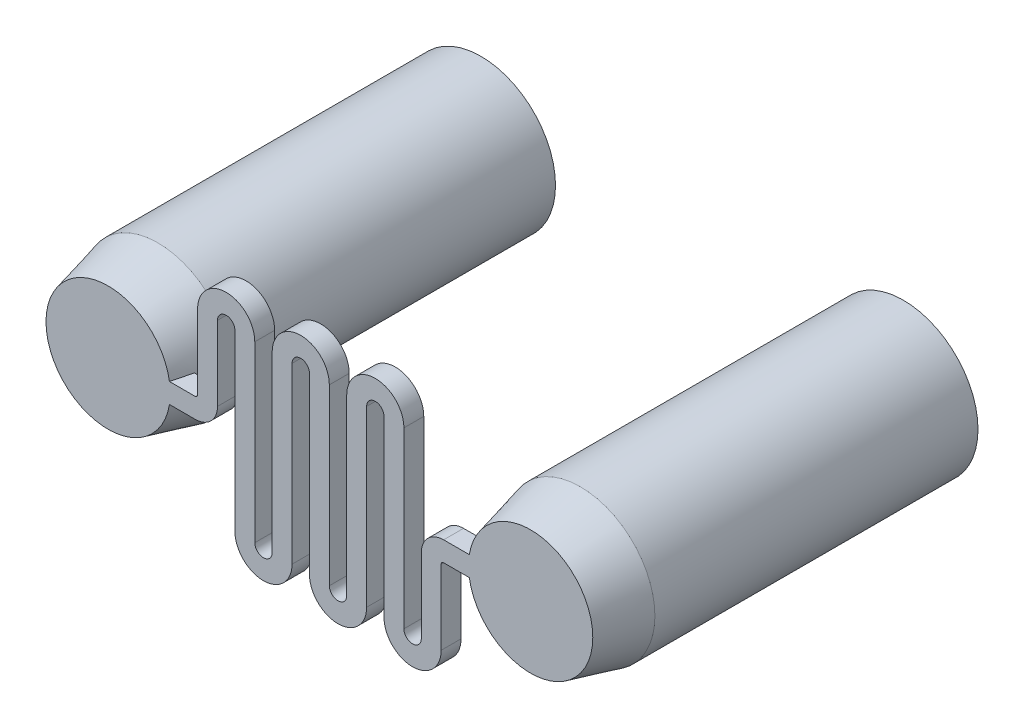
from build123d import *

# Parameters (mm, degrees)
BOSS_EXTRUDE1_DEPTH = 1.6
SKETCH5_R           = 5
CUT_EXTRUDE1_DEPTH  = 28


with BuildPart() as part:
    # Sketch2 → Boss-Extrude1 (new body)
    with BuildSketch(Plane.XY):
        with BuildLine():
            Line((-20.5, -0.8), (-13.5, -0.8))
            ThreePointArc((-13.5, -0.8), (-12.227207794, -0.272792206), (-11.7, 1))
            Line((-11.7, 1), (-11.7, 7))
            ThreePointArc((-11.7, 7), (-11, 7.7), (-10.3, 7))
            Line((-10.3, 7), (-10.3, 0))
            Line((-10.3, 0), (-10.3, -7))
            ThreePointArc((-10.3, -7), (-8, -9.3), (-5.7, -7))
            Line((-5.7, -7), (-5.7, 0))
            Line((-5.7, 0), (-5.7, 7))
            ThreePointArc((-5.7, 7), (-5, 7.7), (-4.3, 7))
            Line((-4.3, 7), (-4.3, 0))
            Line((-4.3, 0), (-4.3, -7))
            ThreePointArc((-4.3, -7), (-2, -9.3), (0.3, -7))
            Line((0.3, -7), (0.3, 0))
            Line((0.3, 0), (0.3, 7))
            ThreePointArc((0.3, 7), (1, 7.7), (1.7, 7))
            Line((1.7, 7), (1.7, 0))
            Line((1.7, 0), (1.7, -7))
            ThreePointArc((1.7, -7), (4, -9.3), (6.3, -7))
            Line((6.3, -7), (6.3, -1))
            ThreePointArc((6.3, -1), (6.358578644, -0.858578644), (6.5, -0.8))
            Line((6.5, -0.8), (13.5, -0.8))
            ThreePointArc((13.5, -0.8), (14.3, 0), (13.5, 0.8))
            Line((13.5, 0.8), (6.5, 0.8))
            ThreePointArc((6.5, 0.8), (5.227207794, 0.272792206), (4.7, -1))
            Line((4.7, -1), (4.7, -7))
            ThreePointArc((4.7, -7), (4, -7.7), (3.3, -7))
            Line((3.3, -7), (3.3, 0))
            Line((3.3, 0), (3.3, 7))
            ThreePointArc((3.3, 7), (1, 9.3), (-1.3, 7))
            Line((-1.3, 7), (-1.3, 0))
            Line((-1.3, 0), (-1.3, -7))
            ThreePointArc((-1.3, -7), (-2, -7.7), (-2.7, -7))
            Line((-2.7, -7), (-2.7, 0))
            Line((-2.7, 0), (-2.7, 7))
            ThreePointArc((-2.7, 7), (-5, 9.3), (-7.3, 7))
            Line((-7.3, 7), (-7.3, 0))
            Line((-7.3, 0), (-7.3, -7))
            ThreePointArc((-7.3, -7), (-8, -7.7), (-8.7, -7))
            Line((-8.7, -7), (-8.7, 0))
            Line((-8.7, 0), (-8.7, 7))
            ThreePointArc((-8.7, 7), (-11, 9.3), (-13.3, 7))
            Line((-13.3, 7), (-13.3, 1))
            ThreePointArc((-13.3, 1), (-13.358578644, 0.858578644), (-13.5, 0.8))
            Line((-13.5, 0.8), (-20.5, 0.8))
            ThreePointArc((-20.5, 0.8), (-21.3, 0), (-20.5, -0.8))
        make_face()
    extrude(amount=BOSS_EXTRUDE1_DEPTH)

    # Sketch3 → Revolve1 (revolve)
    with BuildSketch(Plane(origin=(0, 0, 0), x_dir=(1, 0, 0), z_dir=(0, 1, 0)), mode=Mode.PRIVATE) as revolve1_sk:
        Polygon((-20.5, -1.6), (-25.5, -1.6), (-26.5, 2.4), (-26.5, 28.4), (-20.5, 28.4), align=None)
    revolve(revolve1_sk.sketch.rotate(Axis((-20.5, 0, 1.6), (0, 0, -1)), 189.206896488), axis=Axis((-20.5, 0, 1.6), (0, 0, -1)))

    # Sketch4 → Revolve2 (revolve)
    with BuildSketch(Plane(origin=(0, 0, 0), x_dir=(1, 0, 0), z_dir=(0, 1, 0)), mode=Mode.PRIVATE) as revolve2_sk:
        Polygon((13.5, -1.6), (18.5, -1.6), (19.5, 2.4), (19.5, 28.4), (13.5, 28.4), align=None)
    revolve(revolve2_sk.sketch.rotate(Axis((13.5, 0, 1.6), (0, 0, -1)), 171.480376203), axis=Axis((13.5, 0, 1.6), (0, 0, -1)))

    # Sketch5 → Cut-Extrude1 (cut)
    with BuildSketch(Plane(origin=(0, 0, -28.4), x_dir=(-1, 0, 0), z_dir=(0, 0, -1))):
        with Locations((20.5, 0)):
            Circle(SKETCH5_R)
        with Locations((-13.5, 0)):
            Circle(SKETCH5_R)
    extrude(amount=-CUT_EXTRUDE1_DEPTH, mode=Mode.SUBTRACT)


solid = part.part
